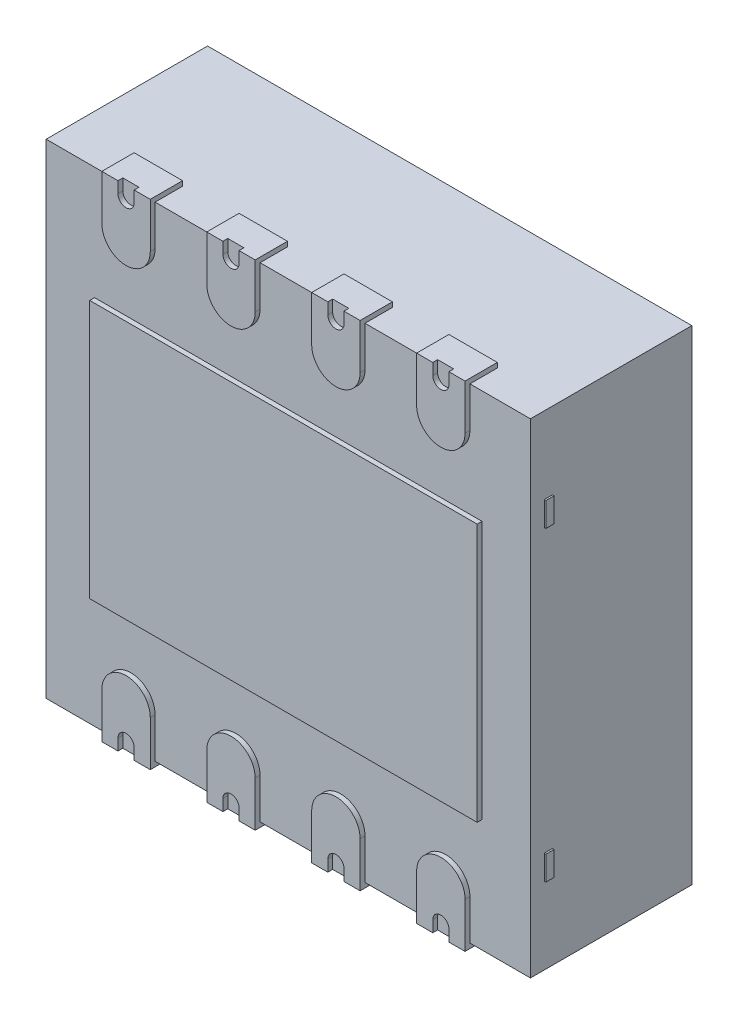
from build123d import *

# Parameters (mm, degrees)
SKETCH1_W            = 3
SKETCH1_H            = 3
BOSS_EXTRUDE1_DEPTH  = 1
SKETCH2_W            = 2.4
SKETCH2_H            = 1.6
BOSS_EXTRUDE2_DEPTH  = 0.03
SKETCH4_W            = 3.940543401
SKETCH4_H            = 3.843561114
SKETCH4_W_2          = 3
SKETCH4_H_2          = 3
CUT_EXTRUDE1_DEPTH   = 60.05
SKETCH7_W            = 0.3
SKETCH7_H            = 0.2
BOSS_EXTRUDE3_DEPTH  = 0.03
CUT_EXTRUDE2_DEPTH   = 0.03
SKETCH9_W            = 0.05
SKETCH9_H            = 0.15
BOSS_EXTRUDE4_DEPTH  = 0.01
BOSS_EXTRUDE9_DEPTH  = 0.01
BOSS_EXTRUDE10_DEPTH = 0.01


with BuildPart() as part:
    # Sketch1 → Boss-Extrude1 (new body)
    with BuildSketch(Plane.XY):
        Rectangle(SKETCH1_W, SKETCH1_H)
    extrude(amount=-BOSS_EXTRUDE1_DEPTH)

    # Sketch2 → Boss-Extrude2 (add)
    with BuildSketch(Plane(origin=(0, 0, 0), x_dir=(-1, 0, 0), z_dir=(0, 0, 1))):
        Rectangle(SKETCH2_W, SKETCH2_H)
        with BuildLine():
            Line((-1.125, 1.25), (-1.125, 1.603517793))
            ThreePointArc((-1.125, 1.603517793), (-0.975, 1.753517793), (-0.825, 1.603517793))
            Line((-0.825, 1.603517793), (-0.825, 1.25))
            ThreePointArc((-0.825, 1.25), (-0.975, 1.1), (-1.125, 1.25))
        make_face()
        with BuildLine():
            Line((-0.175, 1.25), (-0.175, 1.603517793))
            ThreePointArc((-0.175, 1.603517793), (-0.325, 1.753517793), (-0.475, 1.603517793))
            Line((-0.475, 1.603517793), (-0.475, 1.25))
            ThreePointArc((-0.475, 1.25), (-0.325, 1.1), (-0.175, 1.25))
        make_face()
        with BuildLine():
            Line((0.475, 1.25), (0.475, 1.603517793))
            ThreePointArc((0.475, 1.603517793), (0.325, 1.753517793), (0.175, 1.603517793))
            Line((0.175, 1.603517793), (0.175, 1.25))
            ThreePointArc((0.175, 1.25), (0.325, 1.1), (0.475, 1.25))
        make_face()
        with BuildLine():
            Line((1.125, 1.25), (1.125, 1.603517793))
            ThreePointArc((1.125, 1.603517793), (0.975, 1.753517793), (0.825, 1.603517793))
            Line((0.825, 1.603517793), (0.825, 1.25))
            ThreePointArc((0.825, 1.25), (0.975, 1.1), (1.125, 1.25))
        make_face()
        with BuildLine():
            Line((-1.125, -1.25), (-1.125, -1.603517793))
            ThreePointArc((-1.125, -1.603517793), (-0.975, -1.753517793), (-0.825, -1.603517793))
            Line((-0.825, -1.603517793), (-0.825, -1.25))
            ThreePointArc((-0.825, -1.25), (-0.975, -1.1), (-1.125, -1.25))
        make_face()
        with BuildLine():
            Line((-0.475, -1.25), (-0.475, -1.603517793))
            ThreePointArc((-0.475, -1.603517793), (-0.325, -1.753517793), (-0.175, -1.603517793))
            Line((-0.175, -1.603517793), (-0.175, -1.25))
            ThreePointArc((-0.175, -1.25), (-0.325, -1.1), (-0.475, -1.25))
        make_face()
        with BuildLine():
            Line((0.175, -1.25), (0.175, -1.603517793))
            ThreePointArc((0.175, -1.603517793), (0.325, -1.753517793), (0.475, -1.603517793))
            Line((0.475, -1.603517793), (0.475, -1.25))
            ThreePointArc((0.475, -1.25), (0.325, -1.1), (0.175, -1.25))
        make_face()
        with BuildLine():
            Line((0.825, -1.25), (0.825, -1.603517793))
            ThreePointArc((0.825, -1.603517793), (0.975, -1.753517793), (1.125, -1.603517793))
            Line((1.125, -1.603517793), (1.125, -1.25))
            ThreePointArc((1.125, -1.25), (0.975, -1.1), (0.825, -1.25))
        make_face()
    extrude(amount=BOSS_EXTRUDE2_DEPTH)

    # Sketch4 → Cut-Extrude1 (cut)
    with BuildSketch(Plane(origin=(0, 0, -1), x_dir=(-1, 0, 0), z_dir=(0, 0, -1))):
        with Locations((-0.076564963, -0.022969489)):
            Rectangle(SKETCH4_W, SKETCH4_H)
        Rectangle(SKETCH4_W_2, SKETCH4_H_2, mode=Mode.SUBTRACT)
    extrude(amount=-CUT_EXTRUDE1_DEPTH, mode=Mode.SUBTRACT)

    # Sketch7 → Boss-Extrude3 (add)
    with BuildSketch(Plane.XZ.offset(1.5)):
        with Locations((0.975, -0.07)):
            Rectangle(SKETCH7_W, SKETCH7_H)
        with Locations((0.325, -0.07)):
            Rectangle(SKETCH7_W, SKETCH7_H)
        with Locations((-0.325, -0.07)):
            Rectangle(SKETCH7_W, SKETCH7_H)
        with Locations((-0.975, -0.07)):
            Rectangle(SKETCH7_W, SKETCH7_H)
    boss_extrude3 = extrude(amount=BOSS_EXTRUDE3_DEPTH)

    # Mirror1: Boss-Extrude3 across plane
    add(boss_extrude3.mirror(Plane.ZX))

    # Sketch8 → Cut-Extrude2 (cut)
    with BuildSketch(Plane(origin=(0, 0, 0.03), x_dir=(-1, 0, 0), z_dir=(0, 0, 1))):
        with BuildLine():
            Line((-0.925, 1.609812611), (-0.925, 1.459812611))
            ThreePointArc((-0.925, 1.459812611), (-0.975, 1.409812611), (-1.025, 1.459812611))
            Line((-1.025, 1.459812611), (-1.025, 1.609812611))
            ThreePointArc((-1.025, 1.609812611), (-0.975, 1.659812611), (-0.925, 1.609812611))
        make_face()
        with BuildLine():
            Line((-0.375, 1.609812611), (-0.375, 1.459812611))
            ThreePointArc((-0.375, 1.459812611), (-0.325, 1.409812611), (-0.275, 1.459812611))
            Line((-0.275, 1.459812611), (-0.275, 1.609812611))
            ThreePointArc((-0.275, 1.609812611), (-0.325, 1.659812611), (-0.375, 1.609812611))
        make_face()
        with BuildLine():
            Line((0.275, 1.609812611), (0.275, 1.459812611))
            ThreePointArc((0.275, 1.459812611), (0.325, 1.409812611), (0.375, 1.459812611))
            Line((0.375, 1.459812611), (0.375, 1.609812611))
            ThreePointArc((0.375, 1.609812611), (0.325, 1.659812611), (0.275, 1.609812611))
        make_face()
        with BuildLine():
            Line((0.925, 1.609812611), (0.925, 1.459812611))
            ThreePointArc((0.925, 1.459812611), (0.975, 1.409812611), (1.025, 1.459812611))
            Line((1.025, 1.459812611), (1.025, 1.609812611))
            ThreePointArc((1.025, 1.609812611), (0.975, 1.659812611), (0.925, 1.609812611))
        make_face()
        with BuildLine():
            Line((-0.925, -1.609812611), (-0.925, -1.459812611))
            ThreePointArc((-0.925, -1.459812611), (-0.975, -1.409812611), (-1.025, -1.459812611))
            Line((-1.025, -1.459812611), (-1.025, -1.609812611))
            ThreePointArc((-1.025, -1.609812611), (-0.975, -1.659812611), (-0.925, -1.609812611))
        make_face()
        with BuildLine():
            Line((-0.275, -1.609812611), (-0.275, -1.459812611))
            ThreePointArc((-0.275, -1.459812611), (-0.325, -1.409812611), (-0.375, -1.459812611))
            Line((-0.375, -1.459812611), (-0.375, -1.609812611))
            ThreePointArc((-0.375, -1.609812611), (-0.325, -1.659812611), (-0.275, -1.609812611))
        make_face()
        with BuildLine():
            Line((0.375, -1.609812611), (0.375, -1.459812611))
            ThreePointArc((0.375, -1.459812611), (0.325, -1.409812611), (0.275, -1.459812611))
            Line((0.275, -1.459812611), (0.275, -1.609812611))
            ThreePointArc((0.275, -1.609812611), (0.325, -1.659812611), (0.375, -1.609812611))
        make_face()
        with BuildLine():
            Line((1.025, -1.609812611), (1.025, -1.459812611))
            ThreePointArc((1.025, -1.459812611), (0.975, -1.409812611), (0.925, -1.459812611))
            Line((0.925, -1.459812611), (0.925, -1.609812611))
            ThreePointArc((0.925, -1.609812611), (0.975, -1.659812611), (1.025, -1.609812611))
        make_face()
    extrude(amount=-CUT_EXTRUDE2_DEPTH, mode=Mode.SUBTRACT)

    # Sketch9 → Boss-Extrude4 (add)
    with BuildSketch(Plane.ZY.offset(1.5)):
        with Locations((-0.110800284, 0.948643646)):
            Rectangle(SKETCH9_W, SKETCH9_H)
        with Locations((-0.110800284, -0.948643646)):
            Rectangle(SKETCH9_W, SKETCH9_H)
    boss_extrude4 = extrude(amount=BOSS_EXTRUDE4_DEPTH)

    # Mirror2: Boss-Extrude4 across plane
    add(boss_extrude4.mirror(Plane(origin=(0, 0, 0), x_dir=(0, 0, 1), z_dir=(1, 0, 0))))

    # Sketch11 → Boss-Extrude9 (add)
    # profile 1 of 2: a face of its own
    with BuildSketch(Plane(origin=(0, 0, -1), x_dir=(-1, 0, 0), z_dir=(0, 0, -1))):
        with BuildLine():
            Line((-0.805854291, 1.038109942), (-0.423255467, 0.605441833))
            Line((-0.423255467, 0.605441833), (-0.423255467, 1.038109942))
            Line((-0.423255467, 1.038109942), (-0.097177649, 1.038109942))
            Line((-0.097177649, 1.038109942), (0.052640904, 0.796577554))
            Line((0.052640904, 0.796577554), (0.201820168, 1.038109942))
            Line((0.201820168, 1.038109942), (0.943650762, 1.038109942))
            ThreePointArc((0.943650762, 1.038109942), (1.045474138, 0.995933319), (1.087650762, 0.894109942))
            Line((1.087650762, 0.894109942), (1.087650762, 0.670379201))
            ThreePointArc((1.087650762, 0.670379201), (1.045474138, 0.568555824), (0.943650762, 0.526379201))
            Line((0.943650762, 0.526379201), (0.543475021, 0.526379201))
            Line((0.543475021, 0.526379201), (0.543475021, 0.206356726))
            Line((0.543475021, 0.206356726), (0.201820168, 0.206356726))
            Line((0.201820168, 0.206356726), (0.052640904, 0.446858476))
            Line((0.052640904, 0.446858476), (-0.093279754, 0.210602016))
            Line((-0.093279754, 0.210602016), (-0.396062037, 0.210602016))
            Line((-0.396062037, 0.210602016), (-0.788189355, 0.654045576))
            Line((-0.788189355, 0.654045576), (-0.788189355, 0.214790298))
            Line((-0.788189355, 0.214790298), (-1.067573051, 0.214790298))
            Line((-1.067573051, 0.214790298), (-1.067573051, 1.038109942))
            Line((-1.067573051, 1.038109942), (-0.805854291, 1.038109942))
        make_face()
        Polygon((-0.362302815, 0.999733668), (-0.118839535, 0.999733668), (0.05523679, 0.721091876), (0.222284334, 0.999733668), (0.465308002, 0.999733668), (0.23905049, 0.622327348), (0.473025575, 0.247806363), (0.231595523, 0.247806363), (0.05523679, 0.530101575), (-0.112552144, 0.250223114), (-0.362302815, 0.250223114), (-0.125560237, 0.626220348), align=None, mode=Mode.SUBTRACT)
        with BuildLine():
            Line((0.51730694, 0.999733668), (0.910767238, 0.994219094))
            ThreePointArc((0.910767238, 0.994219094), (1.011989543, 0.950619639), (1.052735051, 0.84821519))
            Line((1.052735051, 0.84821519), (1.050676437, 0.701334767))
            ThreePointArc((1.050676437, 0.701334767), (1.007797951, 0.600818431), (0.906690578, 0.559352812))
            Line((0.906690578, 0.559352812), (0.501176929, 0.559352812))
            Line((0.501176929, 0.559352812), (0.501176929, 0.269954806))
            Line((0.501176929, 0.269954806), (0.288716116, 0.622327348))
            Line((0.288716116, 0.622327348), (0.51730694, 0.999733668))
        make_face(mode=Mode.SUBTRACT)
        Polygon((-1.028178054, 0.254481122), (-1.028178054, 0.991192026), (-0.812896495, 0.991192026), (-0.374426195, 0.481817999), (-0.374426195, 0.939702526), (-0.178785, 0.626220348), (-0.398074818, 0.261293182), (-0.82547709, 0.757809403), (-0.82547709, 0.254481122), align=None, mode=Mode.SUBTRACT)
    # profile 2 of 2: a face of its own
    with BuildSketch(Plane(origin=(0, 0, -1), x_dir=(-1, 0, 0), z_dir=(0, 0, -1))):
        with BuildLine():
            Line((0.501176929, 0.890202885), (0.501176929, 0.670379201))
            Line((0.501176929, 0.670379201), (0.874246648, 0.670379201))
            ThreePointArc((0.874246648, 0.670379201), (0.908187774, 0.684438075), (0.922246648, 0.718379201))
            Line((0.922246648, 0.718379201), (0.922246648, 0.842202885))
            ThreePointArc((0.922246648, 0.842202885), (0.908187774, 0.876144011), (0.874246648, 0.890202885))
            Line((0.874246648, 0.890202885), (0.501176929, 0.890202885))
        make_face()
        with BuildLine():
            Line((0.539738286, 0.850364718), (0.829407549, 0.850364718))
            ThreePointArc((0.829407549, 0.850364718), (0.863348674, 0.836305844), (0.877407549, 0.802364718))
            Line((0.877407549, 0.802364718), (0.877407549, 0.760827608))
            ThreePointArc((0.877407549, 0.760827608), (0.863348674, 0.726886482), (0.829407549, 0.712827608))
            Line((0.829407549, 0.712827608), (0.539738286, 0.712827608))
            Line((0.539738286, 0.712827608), (0.539738286, 0.850364718))
        make_face(mode=Mode.SUBTRACT)
    extrude(amount=BOSS_EXTRUDE9_DEPTH)

    # Sketch12 → Boss-Extrude10 (add)
    # profile 1 of 7: a face of its own
    with BuildSketch(Plane(origin=(0, 0, -1), x_dir=(-1, 0, 0), z_dir=(0, 0, -1))):
        Polygon((-1.037035456, -0.548636153), (-0.821650841, -0.548636153), (-0.821650841, -0.620431025), (-0.893445713, -0.620431025), (-0.893445713, -0.948636153), (-0.965240585, -0.948636153), (-0.965240585, -0.620431025), (-1.037035456, -0.620431025), align=None)
    # profile 2 of 7: a face of its own
    with BuildSketch(Plane(origin=(0, 0, -1), x_dir=(-1, 0, 0), z_dir=(0, 0, -1))):
        with BuildLine():
            Line((-0.662676482, -0.548636153), (-0.59088161, -0.548636153))
            Line((-0.59088161, -0.548636153), (-0.59088161, -0.814181025))
            add(Edge.make_bspline(
                [(-0.59088161, -0.814181025), (-0.590907932, -0.819256306), (-0.59095865, -0.82903537), (-0.591466423, -0.843113611), (-0.592153022, -0.856021258), (-0.59314179, -0.867737628), (-0.594610382, -0.878262153), (-0.596272382, -0.887621092), (-0.59810603, -0.895852581), (-0.60120351, -0.905064896), (-0.606012259, -0.915266488), (-0.613268798, -0.926285657), (-0.622305512, -0.935859438), (-0.632712821, -0.944175372), (-0.644578415, -0.950760019), (-0.657628938, -0.95551942), (-0.671822672, -0.958362719), (-0.681653617, -0.958712489), (-0.686714944, -0.958892564)],
                knots=[0, 0, 0, 0, 1.22248561, 2.355488409, 3.392943897, 4.335991845, 5.186735882, 5.951517034, 6.625683685, 7.215700098, 8.28923535, 9.333114649, 10.380102123, 11.447198135, 12.530158036, 13.633358744, 14.781567393, 16, 16, 16, 16], degree=3))
            add(Edge.make_bspline(
                [(-0.686714944, -0.958892564), (-0.691988385, -0.958729304), (-0.702389672, -0.958407292), (-0.717644229, -0.955664578), (-0.732305766, -0.951267182), (-0.746298431, -0.944909075), (-0.759813927, -0.936944688), (-0.772606962, -0.92706564), (-0.784944636, -0.915578324), (-0.792258484, -0.906763247), (-0.796009815, -0.902241923)],
                knots=[0, 0, 0, 0, 0.990984786, 1.954608977, 2.90473533, 3.862451285, 4.837525908, 5.848096122, 6.896271184, 8, 8, 8, 8], degree=3))
            Line((-0.796009815, -0.902241923), (-0.741682892, -0.852001538))
            add(Edge.make_bspline(
                [(-0.741682892, -0.852001538), (-0.738838396, -0.85521786), (-0.733515579, -0.861236464), (-0.72549425, -0.86908487), (-0.718258579, -0.875390159), (-0.711437736, -0.87993822), (-0.70500107, -0.883144096), (-0.698810093, -0.885453379), (-0.692671821, -0.886760564), (-0.688616691, -0.886987017), (-0.686634815, -0.887097692)],
                knots=[0, 0, 0, 0, 1.529509877, 2.862124173, 3.996688592, 4.944357383, 5.774364335, 6.554177287, 7.293378699, 8, 8, 8, 8], degree=3))
            add(Edge.make_bspline(
                [(-0.686634815, -0.887097692), (-0.68471658, -0.886997659), (-0.681028445, -0.886805329), (-0.675957117, -0.884667333), (-0.671681662, -0.881310591), (-0.668866954, -0.87745158), (-0.66707324, -0.873506631), (-0.665952494, -0.869693232), (-0.664888904, -0.865122), (-0.66403678, -0.859795227), (-0.663392913, -0.853643431), (-0.663071992, -0.846741295), (-0.66268171, -0.839051521), (-0.662678287, -0.833679547), (-0.662676482, -0.830847692)],
                knots=[0, 0, 0, 0, 1.003927327, 1.930222208, 2.840933547, 3.835773585, 4.407906147, 5.114514582, 5.922289074, 6.876303333, 7.950072246, 9.174518422, 10.510537432, 12, 12, 12, 12], degree=3))
            Line((-0.662676482, -0.830847692), (-0.662676482, -0.548636153))
        make_face()
    # profile 3 of 7: a face of its own
    with BuildSketch(Plane(origin=(0, 0, -1), x_dir=(-1, 0, 0), z_dir=(0, 0, -1))):
        Polygon((-0.375416867, -0.548636153), (-0.308830328, -0.548636153), (-0.147291867, -0.948636153), (-0.223974559, -0.948636153), (-0.255064303, -0.866584871), (-0.429343149, -0.866584871), (-0.460432892, -0.948636153), (-0.537035456, -0.948636153), align=None)
        Polygon((-0.342163662, -0.65592782), (-0.402099559, -0.79479), (-0.282227764, -0.79479), align=None, mode=Mode.SUBTRACT)
    # profile 4 of 7: a face of its own
    with BuildSketch(Plane(origin=(0, 0, -1), x_dir=(-1, 0, 0), z_dir=(0, 0, -1))):
        Polygon((-0.045448918, -0.548636153), (0.065528646, -0.548636153), (0.065528646, -0.948636153), (-0.006266226, -0.948636153), (-0.006266226, -0.61530282), (-0.088317508, -0.61530282), align=None)
    # profile 5 of 7: a face of its own
    with BuildSketch(Plane(origin=(0, 0, -1), x_dir=(-1, 0, 0), z_dir=(0, 0, -1))):
        Polygon((0.349663261, -0.538379743), (0.424503005, -0.538379743), (0.424503005, -0.799918205), (0.460400441, -0.799918205), (0.460400441, -0.866584871), (0.424503005, -0.866584871), (0.424503005, -0.948636153), (0.352708133, -0.948636153), (0.352708133, -0.866584871), (0.183477364, -0.866584871), (0.183477364, -0.793908589), align=None)
        Polygon((0.352708133, -0.799918205), (0.352708133, -0.663780384), (0.264166467, -0.799918205), align=None, mode=Mode.SUBTRACT)
    # profile 6 of 7: a face of its own
    with BuildSketch(Plane(origin=(0, 0, -1), x_dir=(-1, 0, 0), z_dir=(0, 0, -1))):
        Polygon((0.657355569, -0.538379743), (0.732195313, -0.538379743), (0.732195313, -0.799918205), (0.768092749, -0.799918205), (0.768092749, -0.866584871), (0.732195313, -0.866584871), (0.732195313, -0.948636153), (0.660400441, -0.948636153), (0.660400441, -0.866584871), (0.491169672, -0.866584871), (0.491169672, -0.793908589), align=None)
        Polygon((0.660400441, -0.799918205), (0.660400441, -0.663780384), (0.571858774, -0.799918205), align=None, mode=Mode.SUBTRACT)
    # profile 7 of 7: a face of its own
    with BuildSketch(Plane(origin=(0, 0, -1), x_dir=(-1, 0, 0), z_dir=(0, 0, -1))):
        with BuildLine():
            Line((0.896297877, -0.646072051), (0.824503005, -0.646072051))
            add(Edge.make_bspline(
                [(0.824503005, -0.646072051), (0.825009904, -0.642483281), (0.826003646, -0.635447736), (0.828381538, -0.62526202), (0.831225754, -0.615600171), (0.834776611, -0.606492786), (0.83894119, -0.597923643), (0.843677139, -0.589863335), (0.849035658, -0.58234646), (0.85314302, -0.577818265), (0.855192108, -0.57555923)],
                knots=[0, 0, 0, 0, 1.111473889, 2.178970933, 3.205615836, 4.199322666, 5.174200091, 6.12565194, 7.064921805, 8, 8, 8, 8], degree=3))
            add(Edge.make_bspline(
                [(0.855192108, -0.57555923), (0.858147646, -0.572578598), (0.8639727, -0.566704085), (0.87370705, -0.559179483), (0.883910446, -0.552667452), (0.894787522, -0.547504666), (0.906169022, -0.543325989), (0.918145457, -0.540519163), (0.930667886, -0.538656808), (0.939212869, -0.53847336), (0.943573518, -0.538379743)],
                knots=[0, 0, 0, 0, 1.01925491, 2.00884431, 2.983262333, 3.955970413, 4.92937149, 5.924503185, 6.940838805, 8, 8, 8, 8], degree=3))
            add(Edge.make_bspline(
                [(0.943573518, -0.538379743), (0.94745036, -0.538471268), (0.955071449, -0.538651187), (0.966272533, -0.540095479), (0.976951829, -0.542628606), (0.98722222, -0.545940613), (0.996932664, -0.550447153), (1.006297477, -0.555678285), (1.015055008, -0.562094487), (1.023225746, -0.56934415), (1.030732128, -0.577185369), (1.037232688, -0.585566988), (1.042821336, -0.594265114), (1.047425642, -0.603352012), (1.050965728, -0.612843057), (1.053422653, -0.622683423), (1.05503077, -0.632851394), (1.05519098, -0.639762427), (1.055272236, -0.643267564)],
                knots=[0, 0, 0, 0, 1.091422571, 2.145516843, 3.172569842, 4.178562979, 5.178154469, 6.181868002, 7.194278174, 8.227918432, 9.254613415, 10.245994977, 11.209837596, 12.161663635, 13.10878368, 14.055455738, 15.013766427, 16, 16, 16, 16], degree=3))
            add(Edge.make_bspline(
                [(1.055272236, -0.643267564), (1.055105495, -0.647608383), (1.054777233, -0.656154123), (1.052083605, -0.668661447), (1.047867344, -0.680620681), (1.041776546, -0.691864497), (1.034161497, -0.702362296), (1.024818087, -0.711763104), (1.01401244, -0.720214315), (1.005900497, -0.724755996), (1.001746595, -0.727081666)],
                knots=[0, 0, 0, 0, 0.992805628, 1.954529043, 2.915727527, 3.886831945, 4.871318353, 5.87440735, 6.911542536, 8, 8, 8, 8], degree=3))
            add(Edge.make_bspline(
                [(1.001746595, -0.727081666), (1.00459777, -0.728017767), (1.010200201, -0.729857163), (1.018163383, -0.733479833), (1.025735459, -0.73743881), (1.032786041, -0.742038099), (1.039385255, -0.747091723), (1.045492872, -0.752642883), (1.051145383, -0.758679475), (1.056250513, -0.765234699), (1.060781516, -0.772203715), (1.064846944, -0.779425544), (1.068193017, -0.787009706), (1.071027558, -0.794869585), (1.073185616, -0.803075821), (1.074705082, -0.811596616), (1.07558337, -0.820412533), (1.075717324, -0.826385312), (1.075785056, -0.829405384)],
                knots=[0, 0, 0, 0, 1.059543567, 2.081955587, 3.086750234, 4.076226789, 5.052108497, 6.020845489, 6.989030705, 7.970690546, 8.952259656, 9.923888338, 10.895517021, 11.877585046, 12.873342345, 13.889638361, 14.932918083, 16, 16, 16, 16], degree=3))
            add(Edge.make_bspline(
                [(1.075785056, -0.829405384), (1.075647754, -0.833843664), (1.075377021, -0.842595048), (1.073655828, -0.85548494), (1.070451276, -0.867774308), (1.066235511, -0.879604557), (1.060612138, -0.890822966), (1.053994374, -0.901686979), (1.045859812, -0.911819837), (1.036819643, -0.921489426), (1.026780008, -0.930280583), (1.01589541, -0.937902121), (1.004405193, -0.944442757), (0.992236661, -0.949752631), (0.979394041, -0.953841841), (0.96590596, -0.956797711), (0.951715742, -0.958606161), (0.942029809, -0.958795743), (0.937083133, -0.958892564)],
                knots=[0, 0, 0, 0, 1.005138573, 1.981928558, 2.936866704, 3.876260664, 4.820238198, 5.773547, 6.751179199, 7.756627054, 8.768222608, 9.766606018, 10.760583154, 11.757261445, 12.767156078, 13.807575856, 14.880313354, 16, 16, 16, 16], degree=3))
            add(Edge.make_bspline(
                [(0.937083133, -0.958892564), (0.932403658, -0.958790483), (0.923253564, -0.958590877), (0.909869636, -0.956863185), (0.897149479, -0.954076278), (0.885060632, -0.950147902), (0.873649864, -0.94505347), (0.8628137, -0.938987144), (0.852768371, -0.931599033), (0.843401954, -0.92322265), (0.834922223, -0.913824824), (0.827343341, -0.903623251), (0.820832423, -0.892579138), (0.815362768, -0.880739671), (0.810977135, -0.868084079), (0.807517761, -0.854638099), (0.805101332, -0.840375461), (0.804365403, -0.830562462), (0.803990185, -0.82555923)],
                knots=[0, 0, 0, 0, 1.066544725, 2.085487077, 3.070979577, 4.031932826, 4.977951092, 5.916076795, 6.857635327, 7.814973522, 8.776389752, 9.738577119, 10.707772778, 11.69409279, 12.707140348, 13.757286496, 14.856535458, 16, 16, 16, 16], degree=3))
            Line((0.803990185, -0.82555923), (0.875785056, -0.82555923))
            add(Edge.make_bspline(
                [(0.875785056, -0.82555923), (0.876240013, -0.828074921), (0.87712616, -0.832974888), (0.878854536, -0.840068952), (0.881106851, -0.846617211), (0.883711088, -0.852677866), (0.886524056, -0.858330491), (0.889922793, -0.863366321), (0.893658259, -0.867922099), (0.899048563, -0.873338058), (0.906754375, -0.87890273), (0.917159773, -0.883738695), (0.928734793, -0.886573165), (0.936826887, -0.886918961), (0.941009415, -0.887097692)],
                knots=[0, 0, 0, 0, 0.928156231, 1.807827665, 2.648129825, 3.438902246, 4.202261636, 4.936546065, 5.639352463, 6.338805438, 7.70633318, 9.064371875, 10.482673459, 12, 12, 12, 12], degree=3))
            add(Edge.make_bspline(
                [(0.941009415, -0.887097692), (0.943228813, -0.887059633), (0.947576116, -0.886985084), (0.953961657, -0.886158808), (0.960044784, -0.88479793), (0.965836827, -0.882948548), (0.971374658, -0.880630232), (0.976552472, -0.877640903), (0.981475806, -0.87416538), (0.986091138, -0.87025797), (0.9903558, -0.866000292), (0.993904249, -0.861285637), (0.997147275, -0.856494705), (0.999545841, -0.851314055), (1.001647501, -0.846022464), (1.002933824, -0.840427861), (1.003905091, -0.834647608), (1.003961537, -0.830691856), (1.003990185, -0.82868423)],
                knots=[0, 0, 0, 0, 1.110435564, 2.175094844, 3.216326037, 4.226890168, 5.215276772, 6.21526065, 7.213097102, 8.228249917, 9.239874822, 10.221364777, 11.178138315, 12.128914389, 13.072518965, 14.022636769, 14.996447288, 16, 16, 16, 16], degree=3))
            add(Edge.make_bspline(
                [(1.003990185, -0.82868423), (1.003914131, -0.82648855), (1.003762725, -0.822117452), (1.002525722, -0.815738755), (1.000572234, -0.809602962), (0.9978586, -0.803737246), (0.994234844, -0.798163226), (0.989958853, -0.792769071), (0.984693749, -0.787835538), (0.978917224, -0.78295889), (0.972218725, -0.778707923), (0.964924478, -0.774784905), (0.956842778, -0.771663395), (0.948170907, -0.768875307), (0.938744829, -0.766838932), (0.928623076, -0.765360324), (0.917821975, -0.76425973), (0.910376636, -0.764101832), (0.906554287, -0.764020769)],
                knots=[0, 0, 0, 0, 0.809814727, 1.612155564, 2.388397, 3.182215007, 3.988903953, 4.837162975, 5.715530372, 6.646997145, 7.623086902, 8.637258368, 9.698941581, 10.815059213, 11.996518529, 13.252603015, 14.589518788, 16, 16, 16, 16], degree=3))
            Line((0.906554287, -0.764020769), (0.906554287, -0.697354102))
            add(Edge.make_bspline(
                [(0.906554287, -0.697354102), (0.911313339, -0.696948806), (0.920216583, -0.696190577), (0.932574763, -0.694417433), (0.942978758, -0.692047334), (0.951678627, -0.689187937), (0.958902441, -0.685515727), (0.965213125, -0.68146177), (0.970648184, -0.67675369), (0.975241539, -0.671531883), (0.978916079, -0.665924153), (0.981516705, -0.660017658), (0.983234023, -0.653995155), (0.983396738, -0.649875945), (0.983477364, -0.647834871)],
                knots=[0, 0, 0, 0, 1.70044513, 3.18119609, 4.440695891, 5.496282586, 6.431922213, 7.318171381, 8.16090191, 8.983045123, 9.787564368, 10.536848927, 11.275007137, 12, 12, 12, 12], degree=3))
            add(Edge.make_bspline(
                [(0.983477364, -0.647834871), (0.983338261, -0.645230684), (0.983066763, -0.640147861), (0.980958156, -0.63287327), (0.977297854, -0.626388576), (0.972390032, -0.620707423), (0.96640968, -0.615962098), (0.959399659, -0.612517073), (0.951512087, -0.610492967), (0.945962755, -0.610283136), (0.943092749, -0.610174615)],
                knots=[0, 0, 0, 0, 1.009664648, 1.970651636, 2.907870547, 3.878035693, 4.867062054, 5.849714035, 6.887914197, 8, 8, 8, 8], degree=3))
            add(Edge.make_bspline(
                [(0.943092749, -0.610174615), (0.940491411, -0.610302658), (0.93532956, -0.610556735), (0.92778139, -0.612453096), (0.920613143, -0.615645385), (0.913973253, -0.620047363), (0.907957569, -0.625333952), (0.903020428, -0.63159482), (0.898913948, -0.638454866), (0.897173319, -0.643523035), (0.896297877, -0.646072051)],
                knots=[0, 0, 0, 0, 0.98818071, 1.960853194, 2.938124878, 3.957524365, 4.978590984, 5.968022688, 6.978025184, 8, 8, 8, 8], degree=3))
        make_face()
    extrude(amount=BOSS_EXTRUDE10_DEPTH)


solid = part.part
